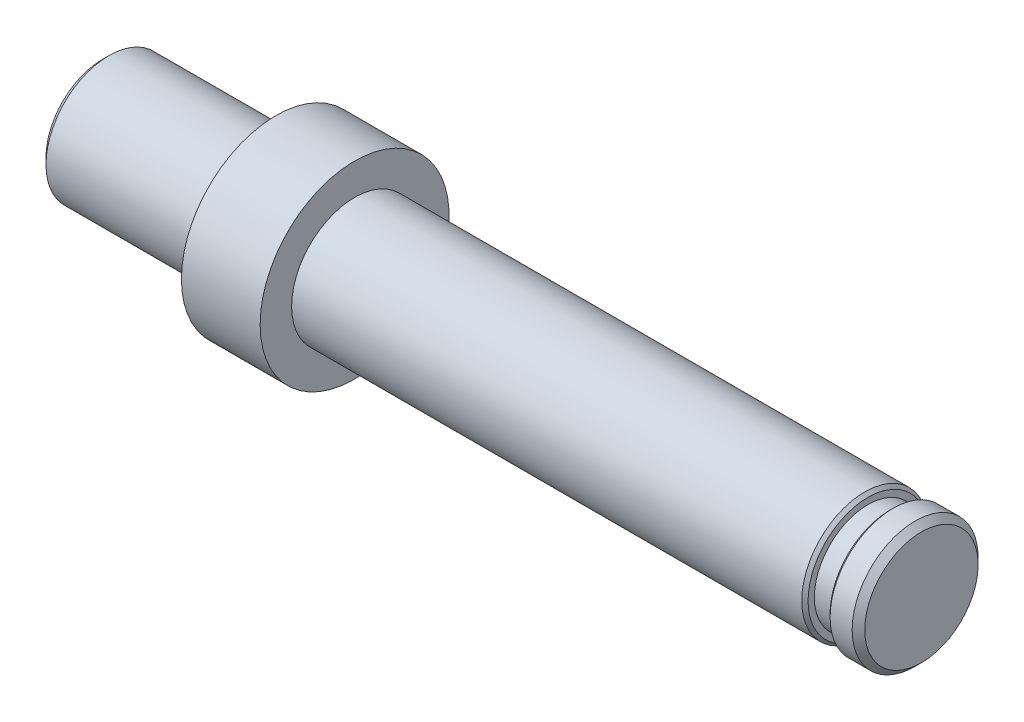
from build123d import *

# Parameters (mm, degrees)
CHAMFER_1_SIZE = 0.2
CHAMFER_2_SIZE = 0.1


with BuildPart() as part:
    # Эскиз1 → Повернуть1 (revolve)
    with BuildSketch(Plane.XY, mode=Mode.PRIVATE) as revolve_1_sk:
        Polygon((0, 0), (26, 0), (26, 2), (25, 2), (25, 1.7), (24.3, 1.7), (24.3, 2), (8, 2), (8, 3), (5.5, 3), (5.5, 2), (0, 2), align=None)
    revolve(revolve_1_sk.sketch.rotate(Axis((0, 0, 0), (1, 0, 0)), 90), axis=Axis((0, 0, 0), (1, 0, 0)))

    # Фаска1
    chamfer_1_edges = [part.edges().sort_by_distance(p)[0] for p in [
        (26, 0, -2),
        (0, 0, -2),
    ]]
    chamfer(chamfer_1_edges, length=CHAMFER_1_SIZE)

    # Фаска2
    chamfer_2_edges = [part.edges().sort_by_distance(p)[0] for p in [
        (24.3, 0, -2),
        (25, 0, -2),
    ]]
    chamfer(chamfer_2_edges, length=CHAMFER_2_SIZE)


solid = part.part
